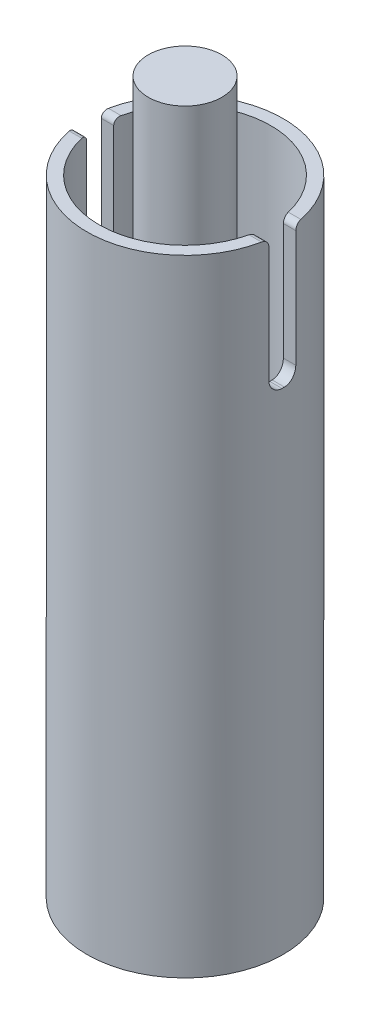
from build123d import *

# Parameters (mm, degrees)
SKETCH_1_R               = 8
EXTRUDE_1_DEPTH          = 51
SKETCH_2_R               = 7
CUT_EXTRUDE_1_DEPTH      = 38
CUT_EXTRUDE_2_DEPTH      = 53.239831546
CUT_EXTRUDE_2_DEPTH_BACK = 53.239831546
SKETCH_3_W               = 2.2
SKETCH_3_H               = 22
FILLET_1_R               = 0.5
FILLET_2_R               = 1
SKETCH_5_R               = 1.5
CUT_EXTRUDE_8_DEPTH      = 38
SKETCH_4_R               = 3
EXTRUDE_2_DEPTH          = 58


with BuildPart() as part:
    # 草图1 → 凸台-拉伸1 (new body)
    with BuildSketch(Plane(origin=(0, 0, 0), x_dir=(1, 0, 0), z_dir=(0, 1, 0))):
        with Locations(Location((0, 0, 0), (0, 0, 270))):
            Circle(SKETCH_1_R)
    extrude(amount=EXTRUDE_1_DEPTH)

    # 草图2 → 切除-拉伸1 (cut)
    with BuildSketch(Plane(origin=(0, 51, 0), x_dir=(1, 0, 0), z_dir=(0, 1, 0))):
        with Locations(Location((0, 0, 0), (0, 0, 270))):
            Circle(SKETCH_2_R)
    extrude(amount=-CUT_EXTRUDE_1_DEPTH, mode=Mode.SUBTRACT)

    # 草图3 → 切除-拉伸2 (cut, two sides: drawn at the far end of the back side and taken through both)
    with BuildSketch(Plane(origin=(0, 0, 0), x_dir=(0, 0, -1), z_dir=(1, 0, 0)).offset(-CUT_EXTRUDE_2_DEPTH_BACK)):
        with Locations((0, 51)):
            Rectangle(SKETCH_3_W, SKETCH_3_H)
    extrude(amount=CUT_EXTRUDE_2_DEPTH + CUT_EXTRUDE_2_DEPTH_BACK, mode=Mode.SUBTRACT)

    # 圆角1
    fillet_1_edges = [part.edges().sort_by_distance(p)[0] for p in [
        (7.418522654, 51, -1.1),
        (-7.418522654, 51, -1.1),
        (-7.418522654, 51, 1.1),
        (7.418522654, 51, 1.1),
    ]]
    fillet(fillet_1_edges, radius=FILLET_1_R)

    # 圆角2
    fillet_2_edges = [part.edges().sort_by_distance(p)[0] for p in [
        (7.418522654, 40, -1.1),
        (-7.418522654, 40, -1.1),
        (7.418522654, 40, 1.1),
        (-7.418522654, 40, 1.1),
    ]]
    fillet(fillet_2_edges, radius=FILLET_2_R)

    # 草图5 → 切除-拉伸8 (cut)
    with BuildSketch(Plane.XZ):
        with Locations(Location((0, 5.5, 0), (0, 0, 270))):
            Circle(SKETCH_5_R)
    extrude(amount=-CUT_EXTRUDE_8_DEPTH, mode=Mode.SUBTRACT)

    # 草图4 → 凸台-拉伸2 (add)
    with BuildSketch(Plane(origin=(0, 0, 0), x_dir=(-1, 0, 0), z_dir=(0, -1, 0))):
        with Locations(Location((0, 0, 0), (0, 0, 90))):
            Circle(SKETCH_4_R)
    extrude(amount=-EXTRUDE_2_DEPTH)


solid = part.part
